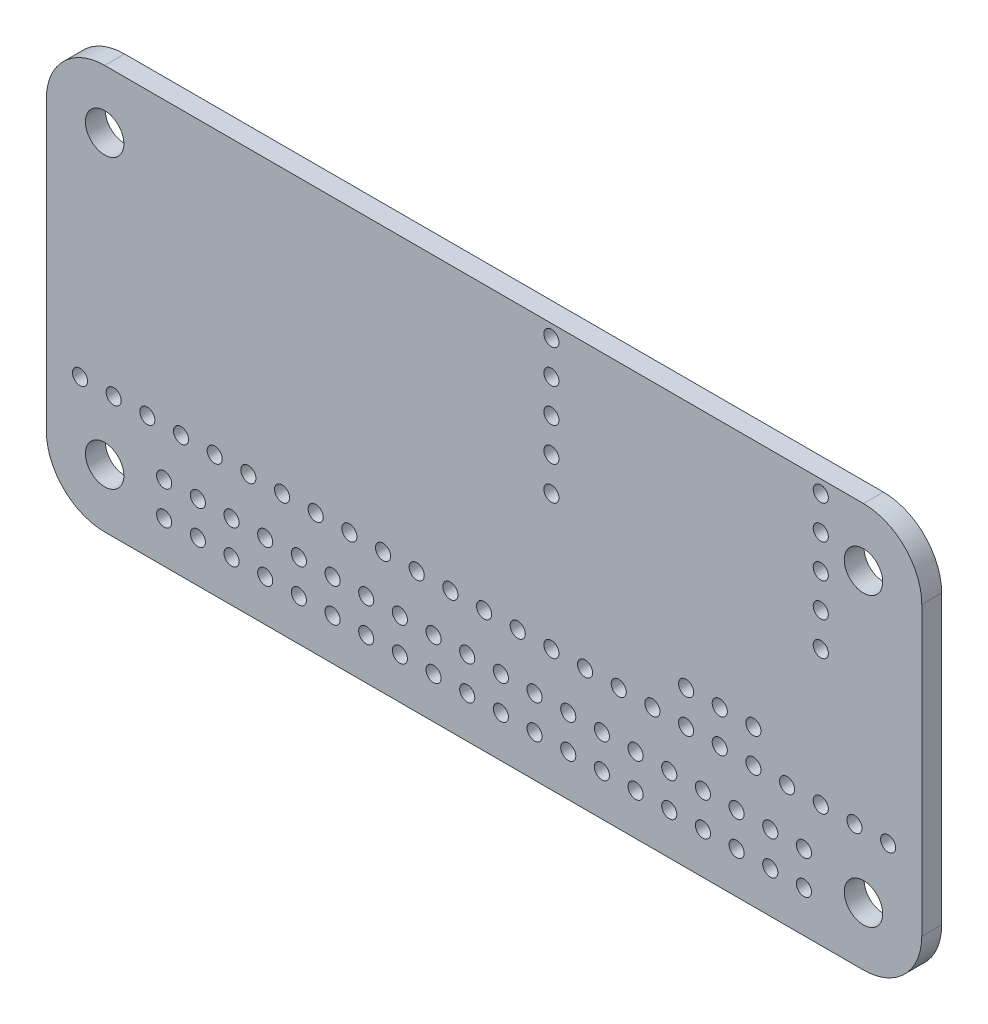
from build123d import *

# Parameters (mm, degrees)
CROQUIS1_R              = 1.45
CROQUIS1_R_2            = 0.57
SALIENTE_EXTRUIR1_DEPTH = 1.5
CROQUIS2_R              = 0.57
CORTAR_EXTRUIR1_DEPTH   = 10


with BuildPart() as part:
    # Croquis1 → Saliente-Extruir1 (new body)
    with BuildSketch(Plane.XY):
        with BuildLine():
            Line((28.62, -15.24), (-28.62, -15.24))
            ThreePointArc((-28.62, -15.24), (-31.731269837, -13.951269837), (-33.02, -10.84))
            Line((-33.02, -10.84), (-33.02, 10.84))
            ThreePointArc((-33.02, 10.84), (-31.731269837, 13.951269837), (-28.62, 15.24))
            Line((-28.62, 15.24), (28.62, 15.24))
            ThreePointArc((28.62, 15.24), (31.731269837, 13.951269837), (33.02, 10.84))
            Line((33.02, 10.84), (33.02, -10.84))
            ThreePointArc((33.02, -10.84), (31.731269837, -13.951269837), (28.62, -15.24))
        make_face()
        with Locations((-28.62, 10.84)):
            Circle(CROQUIS1_R, mode=Mode.SUBTRACT)
        with Locations(Location((28.62, 10.84, 0), (0, 0, 180))):
            Circle(CROQUIS1_R, mode=Mode.SUBTRACT)
        with Locations((28.62, -10.84)):
            Circle(CROQUIS1_R, mode=Mode.SUBTRACT)
        with Locations(Location((-28.62, -10.84, 0), (0, 0, 180))):
            Circle(CROQUIS1_R, mode=Mode.SUBTRACT)
        with Locations((-24.13, -9.57)):
            Circle(CROQUIS1_R_2, mode=Mode.SUBTRACT)
        with Locations((-24.13, -12.11)):
            Circle(CROQUIS1_R_2, mode=Mode.SUBTRACT)
        with Locations((-21.59, -9.57)):
            Circle(CROQUIS1_R_2, mode=Mode.SUBTRACT)
        with Locations((-21.59, -12.11)):
            Circle(CROQUIS1_R_2, mode=Mode.SUBTRACT)
        with Locations((-19.05, -9.57)):
            Circle(CROQUIS1_R_2, mode=Mode.SUBTRACT)
        with Locations((-19.05, -12.11)):
            Circle(CROQUIS1_R_2, mode=Mode.SUBTRACT)
        with Locations((-16.51, -9.57)):
            Circle(CROQUIS1_R_2, mode=Mode.SUBTRACT)
        with Locations((-16.51, -12.11)):
            Circle(CROQUIS1_R_2, mode=Mode.SUBTRACT)
        with Locations((-13.97, -9.57)):
            Circle(CROQUIS1_R_2, mode=Mode.SUBTRACT)
        with Locations((-13.97, -12.11)):
            Circle(CROQUIS1_R_2, mode=Mode.SUBTRACT)
        with Locations((-11.43, -9.57)):
            Circle(CROQUIS1_R_2, mode=Mode.SUBTRACT)
        with Locations((-11.43, -12.11)):
            Circle(CROQUIS1_R_2, mode=Mode.SUBTRACT)
        with Locations((-8.89, -9.57)):
            Circle(CROQUIS1_R_2, mode=Mode.SUBTRACT)
        with Locations((-8.89, -12.11)):
            Circle(CROQUIS1_R_2, mode=Mode.SUBTRACT)
        with Locations((-6.35, -9.57)):
            Circle(CROQUIS1_R_2, mode=Mode.SUBTRACT)
        with Locations((-6.35, -12.11)):
            Circle(CROQUIS1_R_2, mode=Mode.SUBTRACT)
        with Locations((-3.81, -9.57)):
            Circle(CROQUIS1_R_2, mode=Mode.SUBTRACT)
        with Locations((-3.81, -12.11)):
            Circle(CROQUIS1_R_2, mode=Mode.SUBTRACT)
        with Locations((-1.27, -9.57)):
            Circle(CROQUIS1_R_2, mode=Mode.SUBTRACT)
        with Locations((-1.27, -12.11)):
            Circle(CROQUIS1_R_2, mode=Mode.SUBTRACT)
        with Locations((1.27, -9.57)):
            Circle(CROQUIS1_R_2, mode=Mode.SUBTRACT)
        with Locations((1.27, -12.11)):
            Circle(CROQUIS1_R_2, mode=Mode.SUBTRACT)
        with Locations((3.81, -9.57)):
            Circle(CROQUIS1_R_2, mode=Mode.SUBTRACT)
        with Locations((3.81, -12.11)):
            Circle(CROQUIS1_R_2, mode=Mode.SUBTRACT)
        with Locations((6.35, -9.57)):
            Circle(CROQUIS1_R_2, mode=Mode.SUBTRACT)
        with Locations((6.35, -12.11)):
            Circle(CROQUIS1_R_2, mode=Mode.SUBTRACT)
        with Locations((8.89, -9.57)):
            Circle(CROQUIS1_R_2, mode=Mode.SUBTRACT)
        with Locations((8.89, -12.11)):
            Circle(CROQUIS1_R_2, mode=Mode.SUBTRACT)
        with Locations((11.43, -9.57)):
            Circle(CROQUIS1_R_2, mode=Mode.SUBTRACT)
        with Locations((11.43, -12.11)):
            Circle(CROQUIS1_R_2, mode=Mode.SUBTRACT)
        with Locations((13.97, -9.57)):
            Circle(CROQUIS1_R_2, mode=Mode.SUBTRACT)
        with Locations((13.97, -12.11)):
            Circle(CROQUIS1_R_2, mode=Mode.SUBTRACT)
        with Locations((16.51, -9.57)):
            Circle(CROQUIS1_R_2, mode=Mode.SUBTRACT)
        with Locations((16.51, -12.11)):
            Circle(CROQUIS1_R_2, mode=Mode.SUBTRACT)
        with Locations((19.05, -9.57)):
            Circle(CROQUIS1_R_2, mode=Mode.SUBTRACT)
        with Locations((19.05, -12.11)):
            Circle(CROQUIS1_R_2, mode=Mode.SUBTRACT)
        with Locations((21.59, -9.57)):
            Circle(CROQUIS1_R_2, mode=Mode.SUBTRACT)
        with Locations((21.59, -12.11)):
            Circle(CROQUIS1_R_2, mode=Mode.SUBTRACT)
        with Locations((24.13, -9.57)):
            Circle(CROQUIS1_R_2, mode=Mode.SUBTRACT)
        with Locations((24.13, -12.11)):
            Circle(CROQUIS1_R_2, mode=Mode.SUBTRACT)
    extrude(amount=SALIENTE_EXTRUIR1_DEPTH)

    # Croquis2 → Cortar-Extruir1 (cut)
    with BuildSketch(Plane(origin=(0, 0, 0), x_dir=(-1, 0, 0), z_dir=(0, 0, -1))):
        with Locations((-30.48, -6.04)):
            Circle(CROQUIS2_R)
        with Locations((-27.94, -6.04)):
            Circle(CROQUIS2_R)
        with Locations((-25.4, -6.04)):
            Circle(CROQUIS2_R)
        with Locations((-22.86, -6.04)):
            Circle(CROQUIS2_R)
        with Locations((-20.32, -6.04)):
            Circle(CROQUIS2_R)
        with Locations((-17.78, -6.04)):
            Circle(CROQUIS2_R)
        with Locations((-15.24, -6.04)):
            Circle(CROQUIS2_R)
        with Locations((-12.7, -6.04)):
            Circle(CROQUIS2_R)
        with Locations((-10.16, -6.04)):
            Circle(CROQUIS2_R)
        with Locations((-7.62, -6.04)):
            Circle(CROQUIS2_R)
        with Locations((-5.08, -6.04)):
            Circle(CROQUIS2_R)
        with Locations((-2.54, -6.04)):
            Circle(CROQUIS2_R)
        with Locations((0, -6.04)):
            Circle(CROQUIS2_R)
        with Locations((2.54, -6.04)):
            Circle(CROQUIS2_R)
        with Locations((5.08, -6.04)):
            Circle(CROQUIS2_R)
        with Locations((7.62, -6.04)):
            Circle(CROQUIS2_R)
        with Locations((10.16, -6.04)):
            Circle(CROQUIS2_R)
        with Locations((12.7, -6.04)):
            Circle(CROQUIS2_R)
        with Locations((15.24, -6.04)):
            Circle(CROQUIS2_R)
        with Locations((17.78, -6.04)):
            Circle(CROQUIS2_R)
        with Locations((20.32, -6.04)):
            Circle(CROQUIS2_R)
        with Locations((22.86, -6.04)):
            Circle(CROQUIS2_R)
        with Locations((25.4, -6.04)):
            Circle(CROQUIS2_R)
        with Locations((27.94, -6.04)):
            Circle(CROQUIS2_R)
        with Locations((30.48, -6.04)):
            Circle(CROQUIS2_R)
        with Locations(Location((-5.08, 14.28, 0), (0, 0, 180))):
            Circle(CROQUIS2_R)
        with Locations(Location((-25.4, 14.28, 0), (0, 0, 180))):
            Circle(CROQUIS2_R)
        with Locations(Location((-5.08, 11.74, 0), (0, 0, 180))):
            Circle(CROQUIS2_R)
        with Locations(Location((-25.4, 11.74, 0), (0, 0, 180))):
            Circle(CROQUIS2_R)
        with Locations(Location((-5.08, 9.2, 0), (0, 0, 180))):
            Circle(CROQUIS2_R)
        with Locations(Location((-25.4, 9.2, 0), (0, 0, 180))):
            Circle(CROQUIS2_R)
        with Locations(Location((-5.08, 6.66, 0), (0, 0, 180))):
            Circle(CROQUIS2_R)
        with Locations(Location((-25.4, 6.66, 0), (0, 0, 180))):
            Circle(CROQUIS2_R)
        with Locations(Location((-5.08, 4.12, 0), (0, 0, 180))):
            Circle(CROQUIS2_R)
        with Locations(Location((-25.4, 4.12, 0), (0, 0, 180))):
            Circle(CROQUIS2_R)
        with Locations(Location((-15.24, -3.5, 0), (0, 0, 180))):
            Circle(CROQUIS2_R)
        with Locations(Location((-17.78, -3.5, 0), (0, 0, 180))):
            Circle(CROQUIS2_R)
        with Locations(Location((-20.32, -3.5, 0), (0, 0, 180))):
            Circle(CROQUIS2_R)
    extrude(amount=-CORTAR_EXTRUIR1_DEPTH, mode=Mode.SUBTRACT)


solid = part.part
